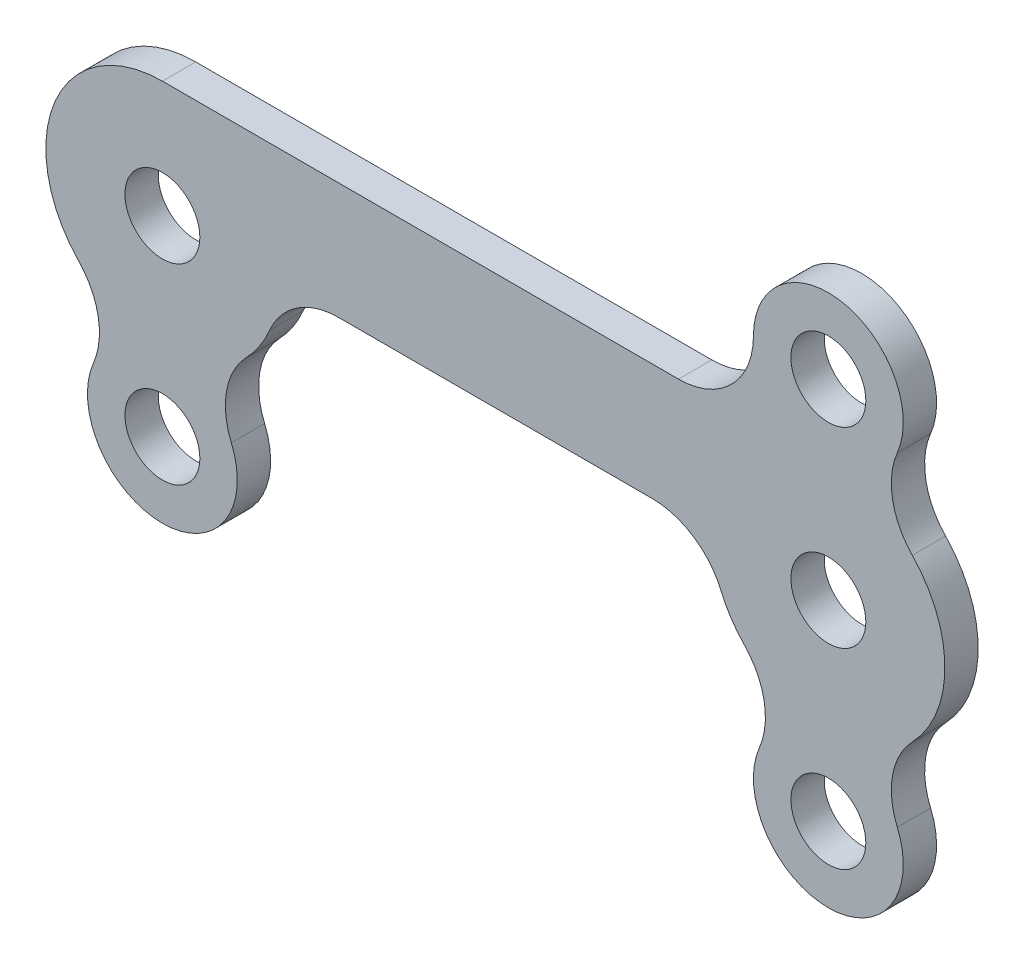
from build123d import *

# Parameters (mm, degrees)
SKETCH1_R           = 1.7859375
SKETCH1_R_2         = 3.571875
BOSS_EXTRUDE1_DEPTH = 1.5875
FILLET1_R           = 3.571875


with BuildPart() as part:
    # Sketch1 → Boss-Extrude1 (new body)
    # profile 1 of 10: a face of its own
    with BuildSketch(Plane.XY):
        with BuildLine():
            Line((5.55625, 0), (26.19375, 0))
            ThreePointArc((26.19375, 0), (27.821137947, -3.928862053), (31.75, -5.55625))
            ThreePointArc((31.75, -5.55625), (37.30625, 0), (31.75, 5.55625))
            Line((31.75, 5.55625), (0, 5.55625))
            ThreePointArc((0, 5.55625), (-5.55625, 0), (0, -5.55625))
            ThreePointArc((0, -5.55625), (3.928862053, -3.928862053), (5.55625, 0))
        make_face()
        Circle(SKETCH1_R, mode=Mode.SUBTRACT)
        with Locations((31.75, 0)):
            Circle(SKETCH1_R, mode=Mode.SUBTRACT)
    # profile 2 of 10: a face of its own
    with BuildSketch(Plane.XY):
        with Locations((0, -9.128125)):
            Circle(SKETCH1_R_2)
        with Locations((0, -9.128125)):
            Circle(SKETCH1_R, mode=Mode.SUBTRACT)
    # profile 3 of 10: a face of its own
    with BuildSketch(Plane.XY):
        with Locations((31.75, -9.128125)):
            Circle(SKETCH1_R_2)
        with Locations((31.75, -9.128125)):
            Circle(SKETCH1_R, mode=Mode.SUBTRACT)
    # profile 4 of 10: a face of its own
    with BuildSketch(Plane.XY):
        with Locations((31.75, 9.128125)):
            Circle(SKETCH1_R_2)
        with Locations((31.75, 9.128125)):
            Circle(SKETCH1_R, mode=Mode.SUBTRACT)
    # profile 5 of 10: a face of its own
    with BuildSketch(Plane.XY):
        with BuildLine():
            ThreePointArc((28.178125, 9.128125), (27.131947034, 6.602427966), (24.60625, 5.55625))
            Line((24.60625, 5.55625), (31.75, 5.55625))
            ThreePointArc((31.75, 5.55625), (29.224302966, 6.602427966), (28.178125, 9.128125))
        make_face()
    # profile 6 of 10: a face of its own
    with BuildSketch(Plane.XY):
        with BuildLine():
            ThreePointArc((31.75, 5.55625), (33.924184828, 5.113201971), (35.751636409, 3.854714012))
            ThreePointArc((35.751636409, 3.854714012), (34.811446668, 5.68510327), (35.037058415, 7.730434766))
            ThreePointArc((35.037058415, 7.730434766), (33.720522292, 6.148975304), (31.75, 5.55625))
        make_face()
    # profile 7 of 10: a face of its own
    with BuildSketch(Plane.XY):
        with BuildLine():
            ThreePointArc((35.751636291, -3.854714135), (33.92418475, -5.113202004), (31.75, -5.55625))
            ThreePointArc((31.75, -5.55625), (33.720522308, -6.148975314), (35.037058429, -7.730434799))
            ThreePointArc((35.037058429, -7.730434799), (34.811446649, -5.685103372), (35.751636291, -3.854714135))
        make_face()
    # profile 8 of 10: a face of its own
    with BuildSketch(Plane.XY):
        with BuildLine():
            ThreePointArc((31.75, -5.55625), (29.575815225, -5.113201993), (27.748363671, -3.854714095))
            ThreePointArc((27.748363671, -3.854714095), (28.48850069, -4.996759503), (28.747758155, -6.332744565))
            ThreePointArc((28.747758155, -6.332744565), (28.675829783, -7.045951842), (28.462941571, -7.730434799))
            ThreePointArc((28.462941571, -7.730434799), (29.779477692, -6.148975314), (31.75, -5.55625))
        make_face()
    # profile 9 of 10: a face of its own
    with BuildSketch(Plane.XY):
        with BuildLine():
            ThreePointArc((3.287058481, -7.730434921), (3.061446618, -5.685103543), (4.001636142, -3.854714289))
            ThreePointArc((4.001636142, -3.854714289), (2.174184651, -5.113202046), (0, -5.55625))
            ThreePointArc((0, -5.55625), (1.970522363, -6.148975351), (3.287058481, -7.730434921))
        make_face()
    # profile 10 of 10: a face of its own
    with BuildSketch(Plane.XY):
        with BuildLine():
            ThreePointArc((-3.287058429, -7.730434799), (-1.970522308, -6.148975314), (0, -5.55625))
            ThreePointArc((0, -5.55625), (-2.174184798, -5.113201984), (-4.001636364, -3.854714059))
            ThreePointArc((-4.001636364, -3.854714059), (-3.26149932, -4.99675948), (-3.002241845, -6.332744565))
            ThreePointArc((-3.002241845, -6.332744565), (-3.074170217, -7.045951842), (-3.287058429, -7.730434799))
        make_face()
    extrude(amount=BOSS_EXTRUDE1_DEPTH)

    # Fillet1
    fillet1_edges = [part.edges().sort_by_distance(p)[0] for p in [
        (26.19375, 0, 0.79375),
        (5.55625, 0, 0.79375),
    ]]
    fillet(fillet1_edges, radius=FILLET1_R)


solid = part.part
